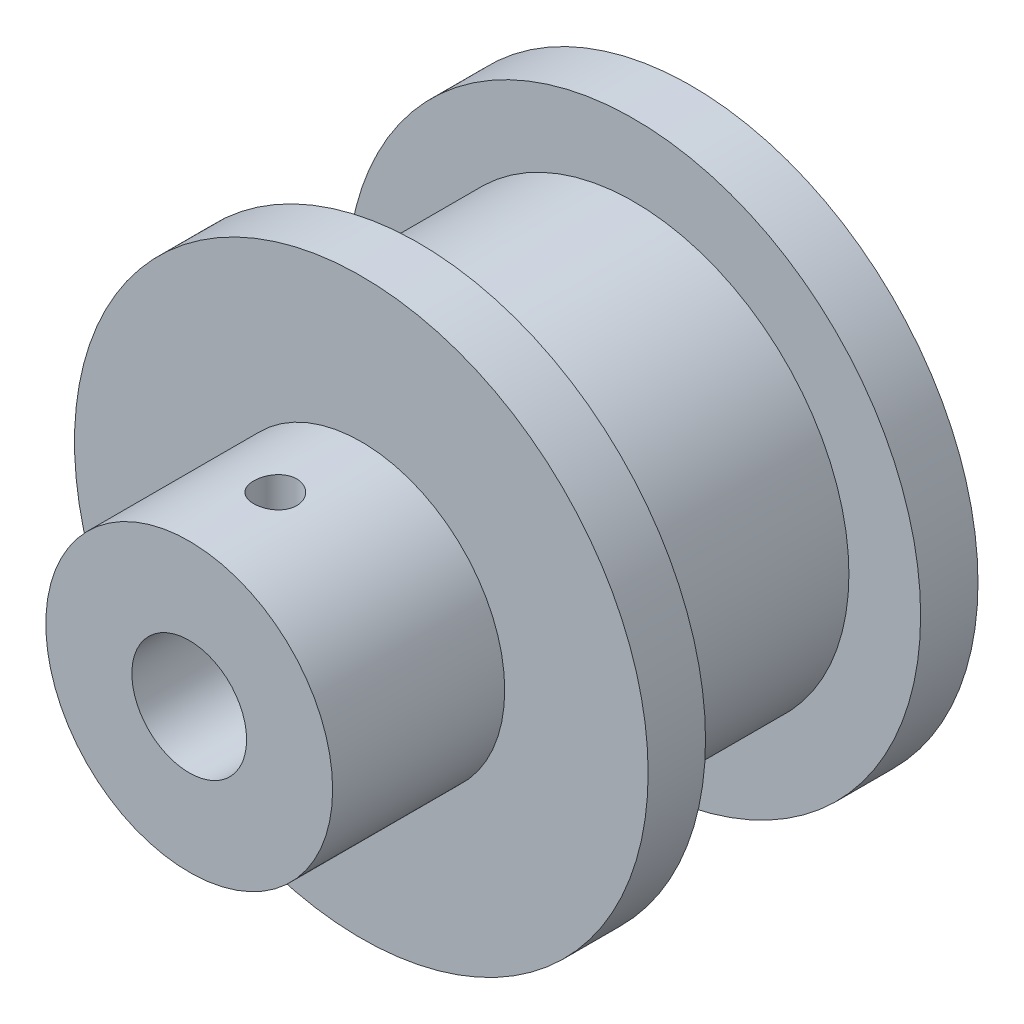
from build123d import *

# Parameters (mm, degrees)
SKETCH_1_R          = 20
EXTRUDE_1_DEPTH     = 4
SKETCH_1_3_R        = 15
EXTRUDE_2_DEPTH     = 15
EXTRUDE_START       = 4
SKETCH_2_R          = 20
EXTRUDE_3_DEPTH     = 4
SKETCH_3_R          = 10
SKETCH_3_R_2        = 4
EXTRUDE_4_DEPTH     = 12
SKETCH_4_R          = 1.5
CUT_EXTRUDE_1_DEPTH = 18
CUT_EXTRUDE_START   = -27
SKETCH_3_3_R        = 4
CUT_EXTRUDE_2_DEPTH = 27


with BuildPart() as part:
    # 스케치1 → 보스-돌출1 (new body)
    with BuildSketch(Plane.XY):
        Circle(SKETCH_1_R)
    extrude(amount=-EXTRUDE_1_DEPTH)

    # 스케치1<3> → 보스-돌출2 (add)
    with BuildSketch(Plane.XY):
        Circle(SKETCH_1_3_R)
    extrude(amount=EXTRUDE_2_DEPTH)

    # 스케치2 → 보스-돌출3 (add)
    with BuildSketch(Plane.XY.offset(15).offset(EXTRUDE_START)):
        Circle(SKETCH_2_R)
    extrude(amount=-EXTRUDE_3_DEPTH)

    # 스케치3 → 보스-돌출4 (add)
    with BuildSketch(Plane.XY.offset(19)):
        Circle(SKETCH_3_R)
        Circle(SKETCH_3_R_2, mode=Mode.SUBTRACT)
    extrude(amount=EXTRUDE_4_DEPTH)

    # 스케치4 → 컷-돌출1 (cut)
    with BuildSketch(Plane(origin=(0, 0, 0), x_dir=(1, 0, 0), z_dir=(0, 1, 0))):
        with Locations((0, -25)):
            Circle(SKETCH_4_R)
    extrude(amount=CUT_EXTRUDE_1_DEPTH, mode=Mode.SUBTRACT)

    # 스케치3<3> → 컷-돌출2 (cut)
    with BuildSketch(Plane.XY.offset(19).offset(CUT_EXTRUDE_START)):
        Circle(SKETCH_3_3_R)
    extrude(amount=CUT_EXTRUDE_2_DEPTH, mode=Mode.SUBTRACT)


solid = part.part
